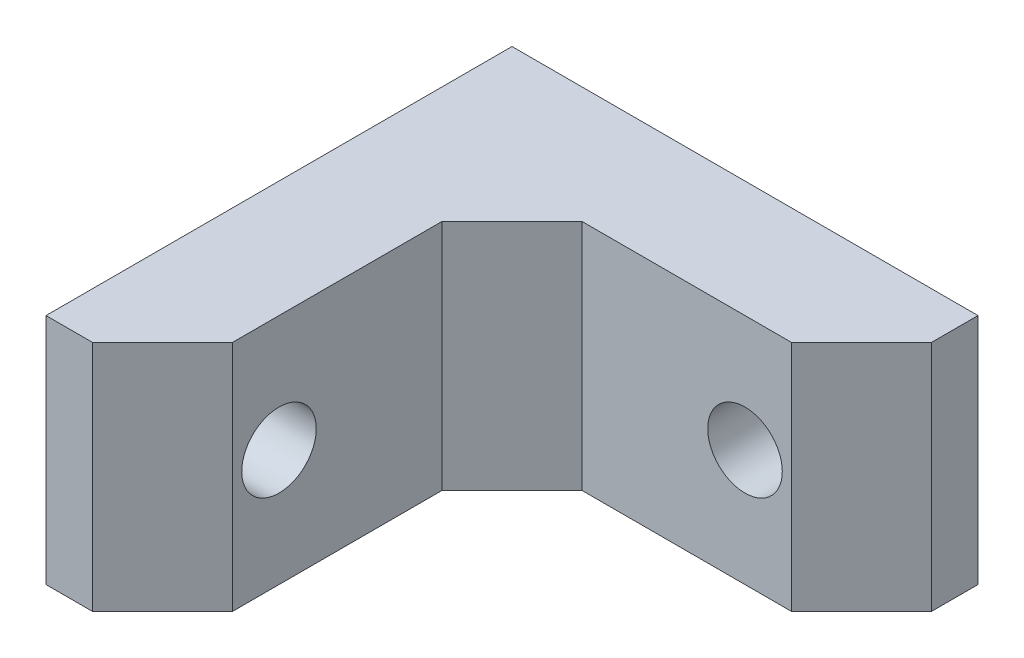
from build123d import *

# Parameters (mm, degrees)
SKIZZE1_W                       = 15
SKIZZE1_H                       = 10
SKIZZE1_R                       = 1.6
AUFSATZ_LINEAR_AUSTRAGEN1_DEPTH = 5
SKIZZE1_9_W                     = 5
SKIZZE1_9_H                     = 10
AUFSATZ_LINEAR_AUSTRAGEN2_DEPTH = 20
SKIZZE3_R                       = 1.6
SCHNITT_LINEAR_AUSTRAGEN2_DEPTH = 20
FASE2_SIZE                      = 3


with BuildPart() as part:
    # Skizze1 → Aufsatz-Linear austragen1 (new body)
    with BuildSketch(Plane.XY):
        with Locations((12.5, 5)):
            Rectangle(SKIZZE1_W, SKIZZE1_H)
        with Locations((15, 5)):
            Circle(SKIZZE1_R, mode=Mode.SUBTRACT)
    extrude(amount=AUFSATZ_LINEAR_AUSTRAGEN1_DEPTH)

    # Skizze1<9> → Aufsatz-Linear austragen2 (add)
    with BuildSketch(Plane.XY):
        with Locations((2.5, 5)):
            Rectangle(SKIZZE1_9_W, SKIZZE1_9_H)
    extrude(amount=AUFSATZ_LINEAR_AUSTRAGEN2_DEPTH)

    # Skizze3 → Schnitt-Linear austragen2 (cut)
    with BuildSketch(Plane(origin=(5, 0, 0), x_dir=(0, 0, -1), z_dir=(1, 0, 0))):
        with Locations((-15, 5)):
            Circle(SKIZZE3_R)
    extrude(amount=-SCHNITT_LINEAR_AUSTRAGEN2_DEPTH, mode=Mode.SUBTRACT)

    # Fase2
    fase2_edges = [part.edges().sort_by_distance(p)[0] for p in [
        (5, 5, 20),
        (20, 5, 5),
        (5, 5, 5),
    ]]
    chamfer(fase2_edges, length=FASE2_SIZE)


solid = part.part
